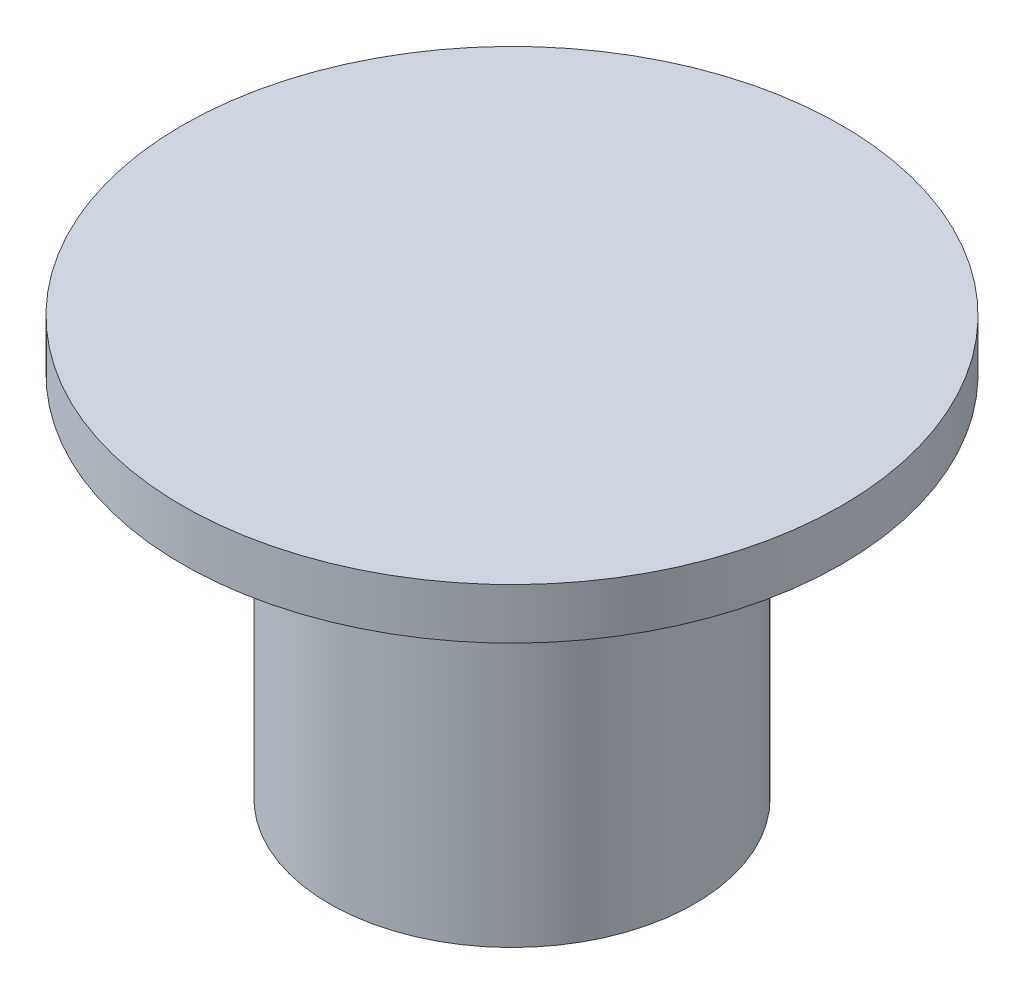
from build123d import *


with BuildPart() as part:
    # 草图1 → 旋转2 (revolve)
    with BuildSketch(Plane.XY, mode=Mode.PRIVATE) as revolve_2_sk:
        Polygon((0, 18), (0, 2), (1.5, 2), (1.6, 2), (1.6, 1.5), (7.2, 1.5), (7.2, 16), (9.2, 16), (13, 16), (13, 18), align=None)
    revolve(revolve_2_sk.sketch.rotate(Axis((0, 18, 0), (0, -1, 0)), 180), axis=Axis((0, 18, 0), (0, -1, 0)))


solid = part.part
